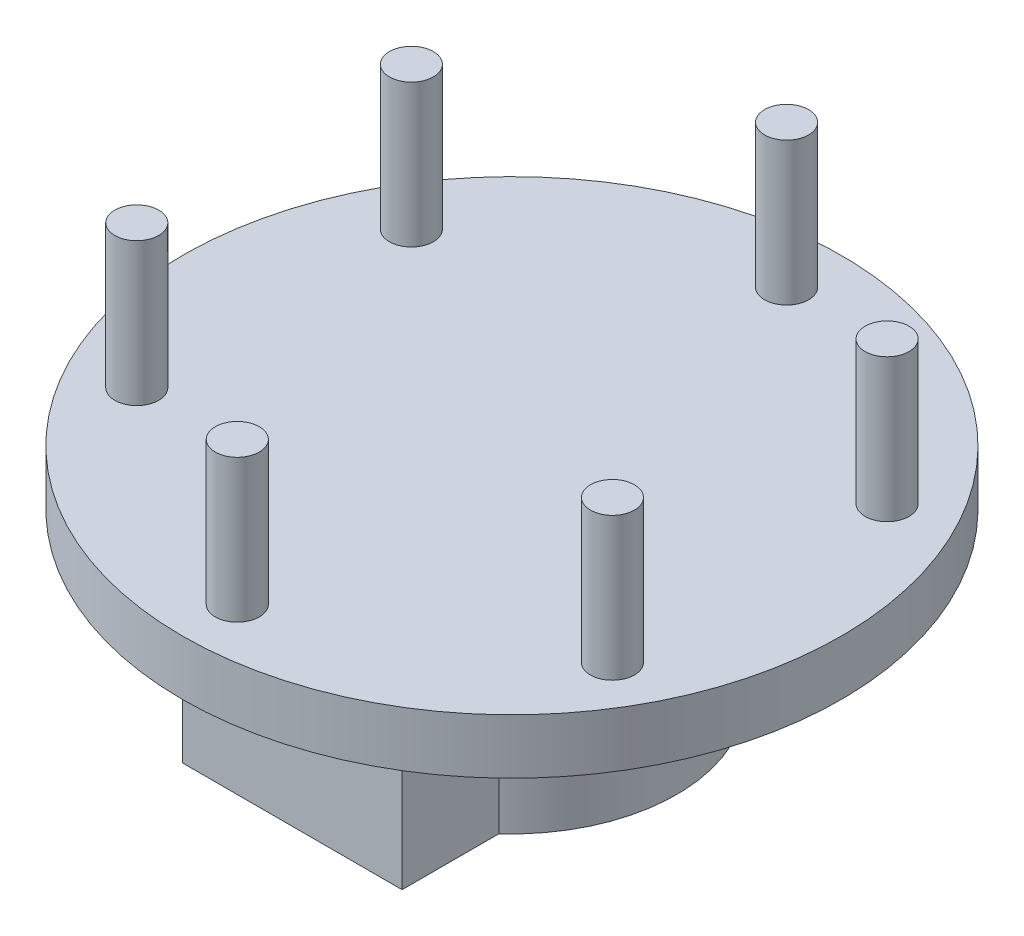
from build123d import *

# Parameters (mm, degrees)
SKETCH1_R           = 30
BOSS_EXTRUDE1_DEPTH = 5
SKETCH2_R           = 2
BOSS_EXTRUDE2_DEPTH = 13
BOSS_EXTRUDE3_DEPTH = 15


with BuildPart() as part:
    # Sketch1 → Boss-Extrude1 (new body)
    with BuildSketch(Plane(origin=(0, 0, 0), x_dir=(1, 0, 0), z_dir=(0, 1, 0))):
        with Locations(Location((0, 0, 0), (0, 0, 270))):
            Circle(SKETCH1_R)
    extrude(amount=BOSS_EXTRUDE1_DEPTH)

    # Sketch2 → Boss-Extrude2 (add)
    with BuildSketch(Plane(origin=(0, 5, 0), x_dir=(1, 0, 0), z_dir=(0, 1, 0))):
        with Locations(Location((0, 25, 0), (0, 0, 90))):
            Circle(SKETCH2_R)
        with Locations(Location((21.650635095, 12.5, 0), (0, 0, 90))):
            Circle(SKETCH2_R)
        with Locations(Location((21.650635095, -12.5, 0), (0, 0, 90))):
            Circle(SKETCH2_R)
        with Locations(Location((0, -25, 0), (0, 0, 90))):
            Circle(SKETCH2_R)
        with Locations(Location((-21.650635095, -12.5, 0), (0, 0, 90))):
            Circle(SKETCH2_R)
        with Locations(Location((-21.650635095, 12.5, 0), (0, 0, 90))):
            Circle(SKETCH2_R)
    extrude(amount=BOSS_EXTRUDE2_DEPTH)

    # Sketch3 → Boss-Extrude3 (add)
    with BuildSketch(Plane.XZ):
        with BuildLine():
            Line((-10, 20), (10, 20))
            Line((10, 20), (10, 11.180339887))
            ThreePointArc((10, 11.180339887), (0, -15), (-10, 11.180339887))
            Line((-10, 11.180339887), (-10, 20))
        make_face()
    extrude(amount=BOSS_EXTRUDE3_DEPTH)


solid = part.part
